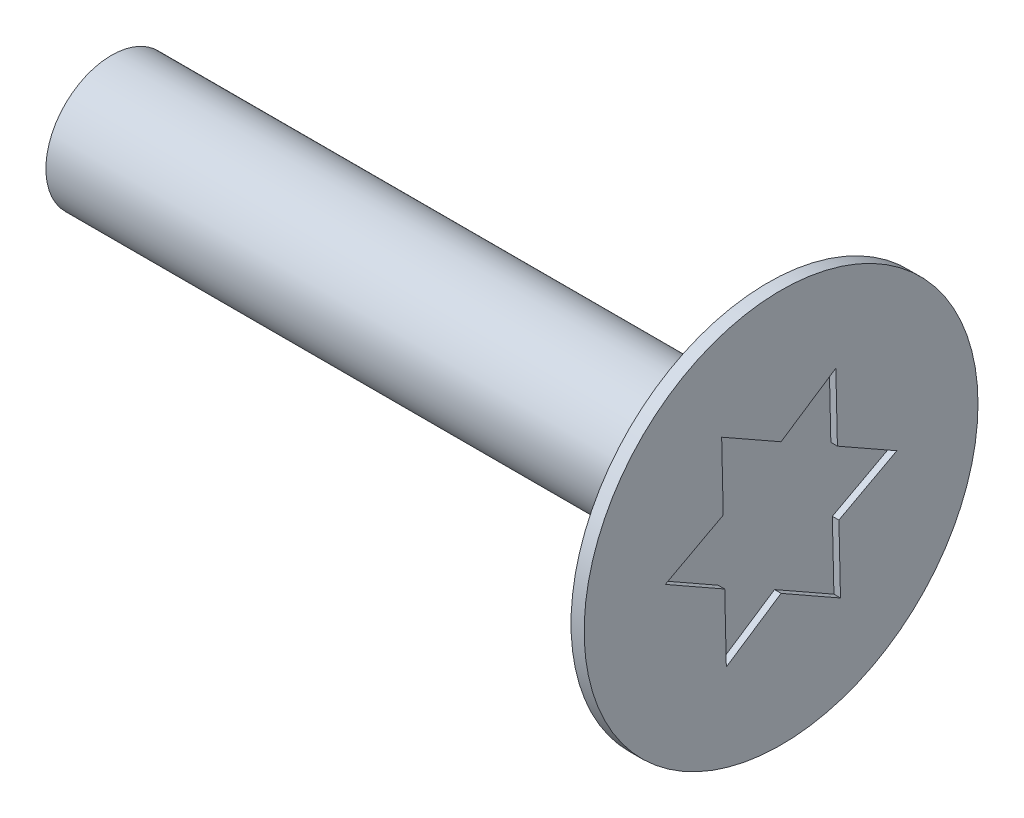
from build123d import *

# Parameters (mm, degrees)
CROQUIS1_R     = 0.5
EXTRUIR1_DEPTH = 5
CROQUIS2_R     = 1.5
EXTRUIR2_DEPTH = 0.1
EXTRUIR3_DEPTH = 0.05


with BuildPart() as part:
    # Croquis1 → Extruir1 (new body)
    with BuildSketch(Plane(origin=(0, 0, 0), x_dir=(0, 0, -1), z_dir=(1, 0, 0))):
        Circle(CROQUIS1_R)
    extrude(amount=EXTRUIR1_DEPTH)

    # Croquis2 → Extruir2 (add)
    with BuildSketch(Plane(origin=(5, 0, 0), x_dir=(0, 0, -1), z_dir=(1, 0, 0))):
        Circle(CROQUIS2_R)
    extrude(amount=EXTRUIR2_DEPTH)

    # Croquis3 → Extruir3 (cut)
    with BuildSketch(Plane(origin=(5.1, 0, 0), x_dir=(0, 0, -1), z_dir=(1, 0, 0))):
        Polygon((0.417078448, 0.776757606), (0.429107469, 0.256645242), (0.88165005, 0), (0.440513561, -0.236532879), (0.452542581, -0.756645242), (0, -0.5), (-0.417078448, -0.776757606), (-0.429107469, -0.256645242), (-0.88165005, 0), (-0.440513561, 0.236532879), (-0.452542581, 0.756645242), (0, 0.5), align=None)
    extrude(amount=-EXTRUIR3_DEPTH, mode=Mode.SUBTRACT)


solid = part.part
